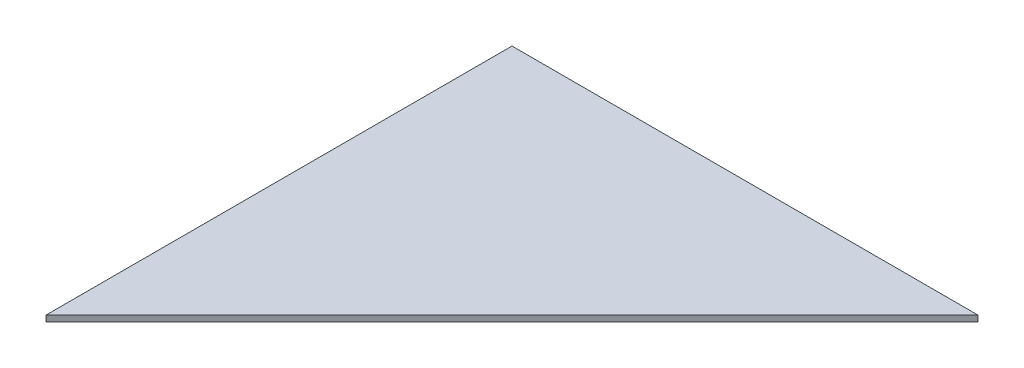
from build123d import *

# Parameters (mm, degrees)
BOSS_EXTRUDE1_DEPTH   = 327.5
BOSS_EXTRUDE1_2_DEPTH = 327.5
BOSS_EXTRUDE2_DEPTH   = 2
BOSS_EXTRUDE4_DEPTH   = 1
SKETCH4_W             = 100
SKETCH4_H             = 8.5
BOSS_EXTRUDE5_DEPTH   = 2
BOSS_EXTRUDE6_DEPTH   = 1
SKETCH7_R             = 5
SKETCH7_W             = 96
SKETCH7_H             = 1
CUT_EXTRUDE2_DEPTH    = 1
SKETCH8_W             = 100
SKETCH8_H             = 13.5
CUT_EXTRUDE3_DEPTH    = 400
SKETCH9_W             = 1
SKETCH9_H             = 5
CUT_EXTRUDE4_DEPTH    = 84.5
BOSS_EXTRUDE8_DEPTH   = 1
SKETCH15_W            = 110.261376908
SKETCH15_H            = 36.265100391
CUT_EXTRUDE7_DEPTH    = 400


with BuildPart() as part:
    # Sketch1 → Boss-Extrude1 (new body)
    with BuildSketch(Plane.XY):
        Polygon((0, 0), (0, 8.5), (1, 8.5), (1, 13.5), (2, 13.5), (2, 2), (13.5, 2), (13.5, 1), (8.5, 1), (8.5, 0), align=None)
    extrude(amount=BOSS_EXTRUDE1_DEPTH)



with BuildPart() as body_2:
    # Sketch1 → Boss-Extrude1 2 (new body)
    with BuildSketch(Plane.XY):
        Polygon((100, 0), (91.5, 0), (91.5, 1), (86.5, 1), (86.5, 2), (98, 2), (98, 13.5), (99, 13.5), (99, 8.5), (100, 8.5), align=None)
    extrude(amount=BOSS_EXTRUDE1_2_DEPTH)


with BuildPart() as part_1:
    add(part.part)

    add(body_2.part)  # Boss-Extrude2 merges body 2
    # Sketch2 → Boss-Extrude2 (add)
    with BuildSketch(Plane(origin=(0, 2, 0), x_dir=(1, 0, 0), z_dir=(0, 1, 0))):
        Polygon((86.5, 0), (13.5, -73), (13.5, -85.02081528), (86.5, -12.02081528), align=None)
    extrude(amount=-BOSS_EXTRUDE2_DEPTH)

    # Sketch3 → Boss-Extrude4 (add)
    with BuildSketch(Plane.XZ.offset(-1)):
        Polygon((13.5, 73), (13.5, 85.02081528), (8.5, 90.02081528), (8.5, 78), align=None)
        Polygon((86.5, 0), (86.5, 12.02081528), (91.5, 7.02081528), (91.5, 0), align=None)
    extrude(amount=BOSS_EXTRUDE4_DEPTH)

    # Sketch4 → Boss-Extrude5 (add)
    with BuildSketch(Plane.XZ):
        with Locations((50, 323.25)):
            Rectangle(SKETCH4_W, SKETCH4_H)
    extrude(amount=-BOSS_EXTRUDE5_DEPTH)

    # Sketch7 → Cut-Extrude2 (cut)
    with BuildSketch(Plane(origin=(0, 2, 0), x_dir=(1, 0, 0), z_dir=(0, 1, 0))):
        with Locations((26.5, -326.5)):
            Circle(SKETCH7_R)
        with Locations((73.5, -326.5)):
            Circle(SKETCH7_R)
        with Locations((50, -327)):
            Rectangle(SKETCH7_W, SKETCH7_H)
    extrude(amount=-CUT_EXTRUDE2_DEPTH, mode=Mode.SUBTRACT)


with BuildPart() as body_2_2:
    # Sketch5 → Boss-Extrude6 (new body)
    with BuildSketch(Plane(origin=(0, 2, 0), x_dir=(1, 0, 0), z_dir=(0, 1, 0))):
        Polygon((13.5, -65.928932188), (79.428932188, 0), (86.5, 0), (13.5, -73), align=None)
    extrude(amount=-BOSS_EXTRUDE6_DEPTH)


with BuildPart() as body_3:
    # Mirror1: mirrored copy
    add(body_2_2.part.mirror(Plane(origin=(1, 13.5, 327.5), x_dir=(0, 0, 1), z_dir=(0, -1, 0))))


with BuildPart() as body_4:
    # Mirror1 2: mirrored copy
    add(part_1.part.mirror(Plane(origin=(1, 13.5, 327.5), x_dir=(0, 0, 1), z_dir=(0, -1, 0))))

    # Sketch9 → Cut-Extrude4 (cut)
    with BuildSketch(Plane(origin=(0, 0, 0), x_dir=(-1, 0, 0), z_dir=(0, 0, -1))):
        with Locations((-1.5, 16)):
            Rectangle(SKETCH9_W, SKETCH9_H)
    extrude(amount=-CUT_EXTRUDE4_DEPTH, mode=Mode.SUBTRACT)


with BuildPart() as cut_extrude3_tool:
    # Sketch8 → Cut-Extrude3 (new body)
    with BuildSketch(Plane(origin=(0, 0, 0), x_dir=(-1, 0, 0), z_dir=(0, 0, -1))):
        with Locations((-50, 6.75)):
            Rectangle(SKETCH8_W, SKETCH8_H)
    extrude(amount=-CUT_EXTRUDE3_DEPTH)


with BuildPart() as part_2:
    add(part_1.part)

    # Cut-Extrude3: cut by cut_extrude3_tool
    add(cut_extrude3_tool.part, mode=Mode.SUBTRACT)


with BuildPart() as body_2_2_1:
    add(body_2_2.part)

    # Cut-Extrude3: cut by cut_extrude3_tool
    add(cut_extrude3_tool.part, mode=Mode.SUBTRACT)


with BuildPart() as body_3_2:
    # Sketch14 → Boss-Extrude8 (new body)
    with BuildSketch(Plane(origin=(0, 27, 0), x_dir=(1, 0, 0), z_dir=(0, 1, 0))):
        Polygon((8.5, 0), (8.5, -78), (86.5, 0), align=None)
    extrude(amount=BOSS_EXTRUDE8_DEPTH)


with BuildPart() as cut_extrude7_tool:
    # Sketch15 → Cut-Extrude7 (new body)
    with BuildSketch(Plane(origin=(0, 0, 0), x_dir=(-1, 0, 0), z_dir=(0, 0, -1))):
        with Locations((-44.869311546, 8.867449804)):
            Rectangle(SKETCH15_W, SKETCH15_H)
    extrude(amount=-CUT_EXTRUDE7_DEPTH)


with BuildPart() as body_3_1:
    add(body_3.part)

    # Cut-Extrude7: cut by cut_extrude7_tool
    add(cut_extrude7_tool.part, mode=Mode.SUBTRACT)


with BuildPart() as body_4_1:
    add(body_4.part)

    # Cut-Extrude7: cut by cut_extrude7_tool
    add(cut_extrude7_tool.part, mode=Mode.SUBTRACT)


solid = body_3_2.part
